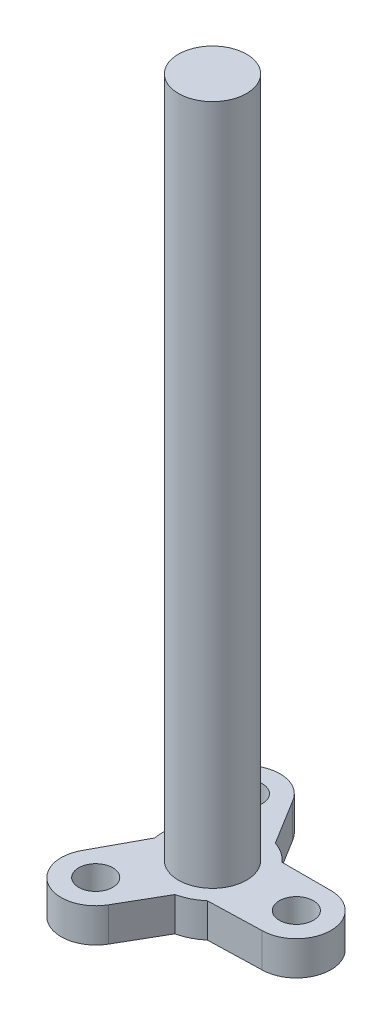
from build123d import *

# Parameters (mm, degrees)
SKETCH1_R           = 2
BOSS_EXTRUDE1_DEPTH = 40
SKETCH2_R           = 1
BOSS_EXTRUDE2_DEPTH = 2


with BuildPart() as part:
    # Sketch1 → Boss-Extrude1 (new body)
    with BuildSketch(Plane(origin=(0, 0, 0), x_dir=(1, 0, 0), z_dir=(0, 1, 0))):
        with Locations(Location((0, 0, 0), (0, 0, 270))):
            Circle(SKETCH1_R)
    extrude(amount=BOSS_EXTRUDE1_DEPTH)


with BuildPart() as body_2:
    # Sketch2 → Boss-Extrude2 (new body)
    with BuildSketch(Plane.XZ):
        with BuildLine():
            Line((2.139742133, -1.953041124), (4.99942355, -1.953041124))
            ThreePointArc((4.99942355, -1.953041124), (7.028386794, 0.07592212), (4.99942355, 2.104885364))
            Line((4.99942355, 2.104885364), (1.891641497, 2.194210216))
            ThreePointArc((1.891641497, 2.194210216), (1.296114465, 2.590936765), (0.621512161, 2.829591606))
            Line((0.621512161, 2.829591606), (-0.808328547, 5.30614836))
            ThreePointArc((-0.808328547, 5.30614836), (-3.579943881, 6.048800451), (-4.322595972, 3.277185117))
            Line((-4.322595972, 3.277185117), (-2.846062537, 0.541104484))
            ThreePointArc((-2.846062537, 0.541104484), (-2.89187429, -0.17300033), (-2.761254294, -0.876550483))
            Line((-2.761254294, -0.876550483), (-4.191095003, -3.353107237))
            ThreePointArc((-4.191095003, -3.353107237), (-3.448442912, -6.124722571), (-0.676827578, -5.38207048))
            Line((-0.676827578, -5.38207048), (0.954421039, -2.7353147))
            ThreePointArc((0.954421039, -2.7353147), (1.595759826, -2.417936435), (2.139742133, -1.953041124))
        make_face()
        with Locations(Location((4.99942355, 0.07592212, 0), (0, 0, 270))):
            Circle(SKETCH2_R, mode=Mode.SUBTRACT)
        with Locations(Location((-2.565462259, 4.291666739, 0), (0, 0, 270))):
            Circle(SKETCH2_R, mode=Mode.SUBTRACT)
        with Locations(Location((-2.43396129, -4.367588858, 0), (0, 0, 270))):
            Circle(SKETCH2_R, mode=Mode.SUBTRACT)
    extrude(amount=BOSS_EXTRUDE2_DEPTH)


solid = Compound([part.part, body_2.part])
